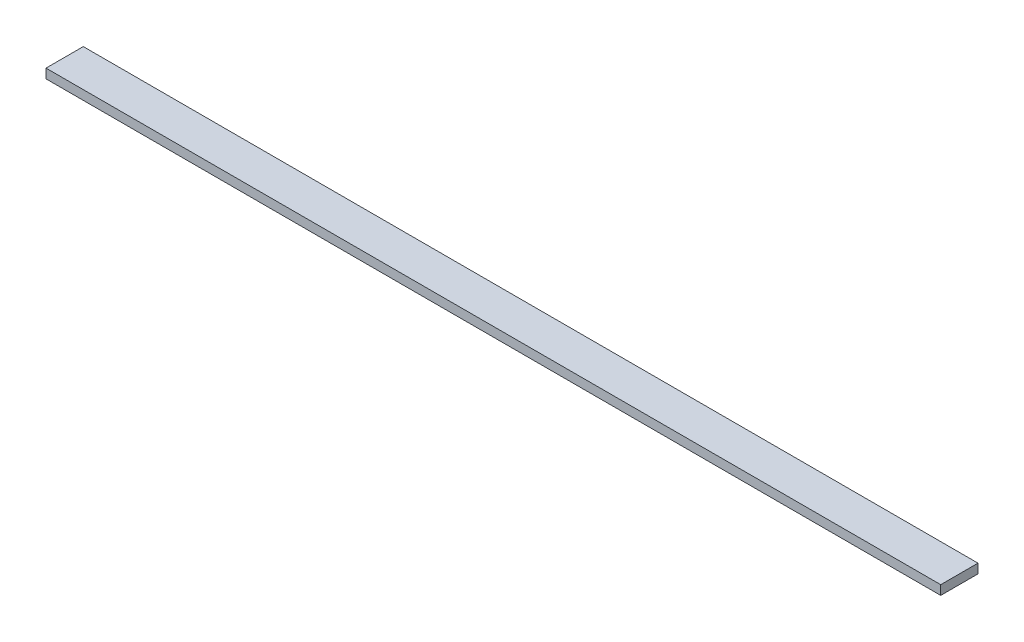
from build123d import *

# Parameters (mm, degrees)
SKETCH1_W           = 304.8
SKETCH1_H           = 12.7
BOSS_EXTRUDE1_DEPTH = 3.175


with BuildPart() as part:
    # Sketch1 → Boss-Extrude1 (new body)
    with BuildSketch(Plane(origin=(0, 0, 0), x_dir=(1, 0, 0), z_dir=(0, 1, 0))):
        Rectangle(SKETCH1_W, SKETCH1_H)
    extrude(amount=BOSS_EXTRUDE1_DEPTH)


solid = part.part
